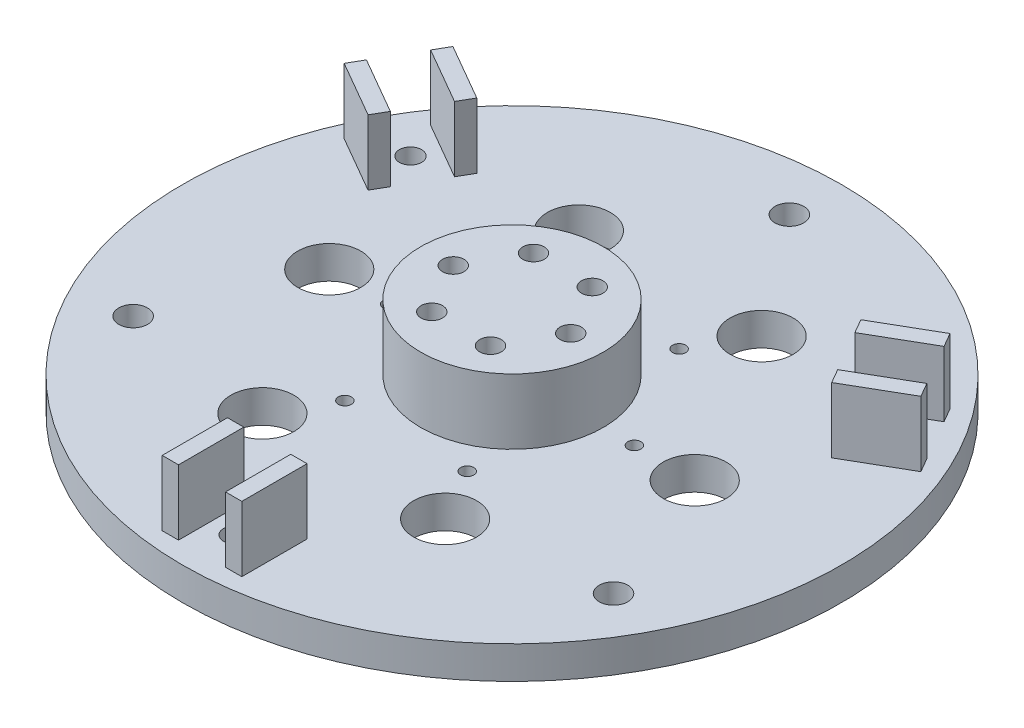
from build123d import *

# Parameters (mm, degrees)
SKETCH1_R           = 50.5
BOSS_EXTRUDE1_DEPTH = 5
SKETCH3_R           = 14
SKETCH3_R_2         = 1.65
BOSS_EXTRUDE2_DEPTH = 10
SKETCH6_R           = 1
CUT_EXTRUDE4_DEPTH  = 10
SKETCH5_R           = 4.835
CUT_EXTRUDE3_DEPTH  = 73.114492302
CUT_EXTRUDE10_REACH = 74.976
SKETCH12_R          = 1.7
SKETCH15_W          = 2.5
SKETCH15_H          = 10
BOSS_EXTRUDE3_DEPTH = 10
CUT_EXTRUDE11_REACH = 74.114
SKETCH13_R          = 2.2
CIRPATTERN1_COUNT   = 3


with BuildPart() as part:
    # Sketch1 → Boss-Extrude1 (new body)
    with BuildSketch(Plane(origin=(0, 0, 0), x_dir=(1, 0, 0), z_dir=(0, 1, 0))):
        with Locations(Location((0, 0, 0), (0, 0, 270))):
            Circle(SKETCH1_R)
    extrude(amount=BOSS_EXTRUDE1_DEPTH)

    # Sketch3 → Boss-Extrude2 (add)
    with BuildSketch(Plane(origin=(0, 5, 0), x_dir=(1, 0, 0), z_dir=(0, 1, 0))):
        with Locations(Location((0, 0, 0), (0, 0, 270))):
            Circle(SKETCH3_R)
        with Locations(Location((9, 0, 0), (0, 0, 270))):
            Circle(SKETCH3_R_2, mode=Mode.SUBTRACT)
        with Locations(Location((4.5, -7.794228634, 0), (0, 0, 270))):
            Circle(SKETCH3_R_2, mode=Mode.SUBTRACT)
        with Locations(Location((-4.5, -7.794228634, 0), (0, 0, 270))):
            Circle(SKETCH3_R_2, mode=Mode.SUBTRACT)
        with Locations(Location((-9, 0, 0), (0, 0, 270))):
            Circle(SKETCH3_R_2, mode=Mode.SUBTRACT)
        with Locations(Location((-4.5, 7.794228634, 0), (0, 0, 270))):
            Circle(SKETCH3_R_2, mode=Mode.SUBTRACT)
        with Locations(Location((4.5, 7.794228634, 0), (0, 0, 270))):
            Circle(SKETCH3_R_2, mode=Mode.SUBTRACT)
    extrude(amount=BOSS_EXTRUDE2_DEPTH)

    # Sketch6 → Cut-Extrude4 (cut)
    with BuildSketch(Plane(origin=(0, 5, 0), x_dir=(1, 0, 0), z_dir=(0, 1, 0))):
        with Locations(Location((18.75, 0, 0), (0, 0, 270))):
            Circle(SKETCH6_R)
        with Locations(Location((9.375, -16.237976321, 0), (0, 0, 270))):
            Circle(SKETCH6_R)
        with Locations(Location((-9.375, -16.237976321, 0), (0, 0, 270))):
            Circle(SKETCH6_R)
        with Locations(Location((-18.75, 0, 0), (0, 0, 270))):
            Circle(SKETCH6_R)
        with Locations(Location((-9.375, 16.237976321, 0), (0, 0, 270))):
            Circle(SKETCH6_R)
        with Locations(Location((9.375, 16.237976321, 0), (0, 0, 270))):
            Circle(SKETCH6_R)
    extrude(amount=-CUT_EXTRUDE4_DEPTH, mode=Mode.SUBTRACT)

    # Sketch5 → Cut-Extrude3 (cut, through all)
    with BuildSketch(Plane(origin=(0, 5, 0), x_dir=(1, 0, 0), z_dir=(0, 1, 0))):
        with Locations(Location((28, 0, 0), (0, 0, 270))):
            Circle(SKETCH5_R)
        with Locations(Location((14, -24.248711306, 0), (0, 0, 270))):
            Circle(SKETCH5_R)
        with Locations(Location((-14, -24.248711306, 0), (0, 0, 270))):
            Circle(SKETCH5_R)
        with Locations(Location((-28, 0, 0), (0, 0, 270))):
            Circle(SKETCH5_R)
        with Locations(Location((-14, 24.248711306, 0), (0, 0, 270))):
            Circle(SKETCH5_R)
        with Locations(Location((14, 24.248711306, 0), (0, 0, 270))):
            Circle(SKETCH5_R)
    extrude(amount=-CUT_EXTRUDE3_DEPTH, mode=Mode.SUBTRACT)

    # Sketch12 → Cut-Extrude10 (cut, up to next)
    with BuildSketch(Plane.XZ, mode=Mode.PRIVATE) as cut_extrude10_sk1:
        with Locations(Location((0, 42.5, 0), (0, 0, 270))):
            Circle(SKETCH12_R)
    cut_extrude10_tool1 = extrude(cut_extrude10_sk1.sketch, amount=-CUT_EXTRUDE10_REACH, mode=Mode.PRIVATE) & part.part
    cut_extrude10 = cut_extrude10_tool1.solids().sort_by_distance((0, 0, 42.5))[0]
    add(cut_extrude10, mode=Mode.SUBTRACT)

    # Sketch15 → Boss-Extrude3 (add)
    with BuildSketch(Plane.XZ.offset(-5)):
        with Locations((-4.85, 42.5)):
            Rectangle(SKETCH15_W, SKETCH15_H)
        with Locations((4.85, 42.5)):
            Rectangle(SKETCH15_W, SKETCH15_H)
    boss_extrude3 = extrude(amount=-BOSS_EXTRUDE3_DEPTH)

    # Sketch13 → Cut-Extrude11 (cut, up to next)
    with BuildSketch(Plane(origin=(0, 5, 0), x_dir=(1, 0, 0), z_dir=(0, 1, 0)), mode=Mode.PRIVATE) as cut_extrude11_sk1:
        with Locations(Location((0, 42.5, 0), (0, 0, 270))):
            Circle(SKETCH13_R)
    cut_extrude11_tool1 = extrude(cut_extrude11_sk1.sketch, amount=-CUT_EXTRUDE11_REACH, mode=Mode.PRIVATE) & part.part
    cut_extrude11 = cut_extrude11_tool1.solids().sort_by_distance((0, 5, -42.5))[0]
    add(cut_extrude11, mode=Mode.SUBTRACT)

    # CirPattern1: Cut-Extrude10, Boss-Extrude3, Cut-Extrude11 ×3 about axis
    cirpattern1_axis = Axis((0, 0, 0), (0, 1, 0))
    add([cut_extrude10.rotate(cirpattern1_axis, i * 360 / CIRPATTERN1_COUNT) for i in range(1, CIRPATTERN1_COUNT)], mode=Mode.SUBTRACT)
    add([boss_extrude3.rotate(cirpattern1_axis, i * 360 / CIRPATTERN1_COUNT) for i in range(1, CIRPATTERN1_COUNT)])
    add([cut_extrude11.rotate(cirpattern1_axis, i * 360 / CIRPATTERN1_COUNT) for i in range(1, CIRPATTERN1_COUNT)], mode=Mode.SUBTRACT)


solid = part.part
